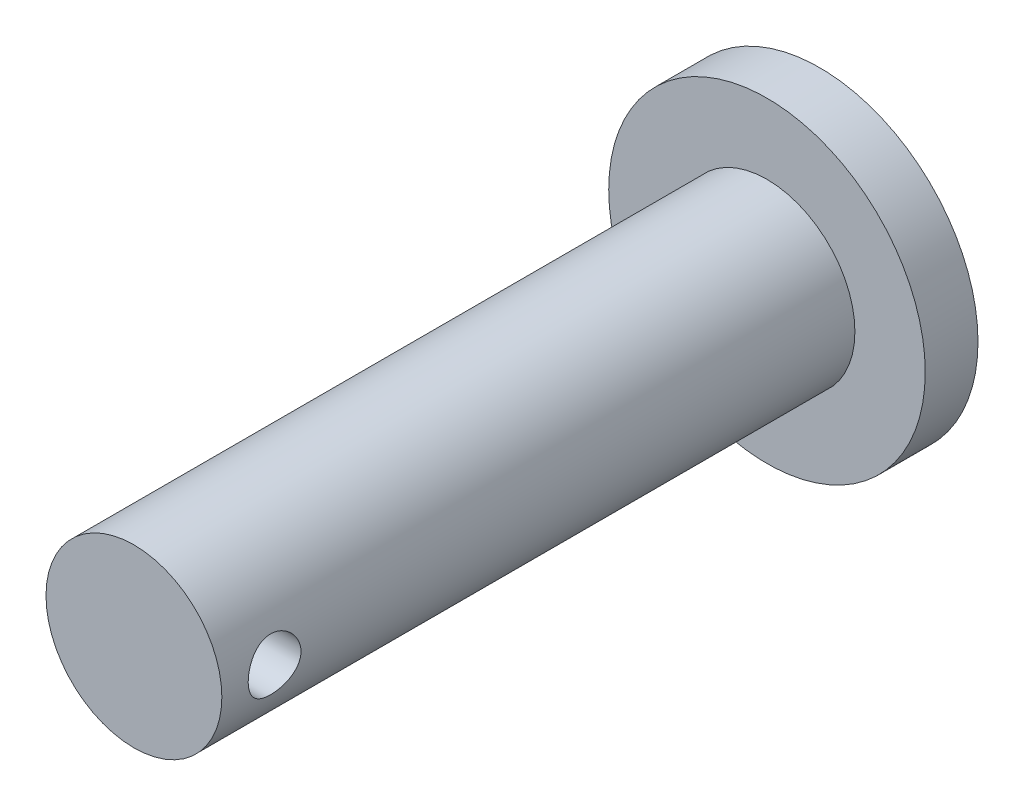
from build123d import *

# Parameters (mm, degrees)
SKETCH1_R               = 5
BOSS_EXTRUDE1_DEPTH     = 36
SKETCH2_R               = 9
BOSS_EXTRUDE2_DEPTH     = 3
CUT_EXTRUDE1_DEPTH      = 39.183766184
CUT_EXTRUDE1_DEPTH_BACK = 39.183766184
SKETCH3_R               = 1.5


with BuildPart() as part:
    # Sketch1 → Boss-Extrude1 (new body)
    with BuildSketch(Plane.XY):
        Circle(SKETCH1_R)
    extrude(amount=BOSS_EXTRUDE1_DEPTH)

    # Sketch2 → Boss-Extrude2 (add)
    with BuildSketch(Plane.XY):
        Circle(SKETCH2_R)
    extrude(amount=-BOSS_EXTRUDE2_DEPTH)

    # Sketch3 → Cut-Extrude1 (cut, two sides: drawn at the far end of the back side and taken through both)
    with BuildSketch(Plane(origin=(0, 0, 0), x_dir=(0, 0, -1), z_dir=(1, 0, 0)).offset(-CUT_EXTRUDE1_DEPTH_BACK)):
        with Locations(Location((-33, 0, 0), (0, 0, 179.999999999))):
            Circle(SKETCH3_R)
    extrude(amount=CUT_EXTRUDE1_DEPTH + CUT_EXTRUDE1_DEPTH_BACK, mode=Mode.SUBTRACT)


solid = part.part
